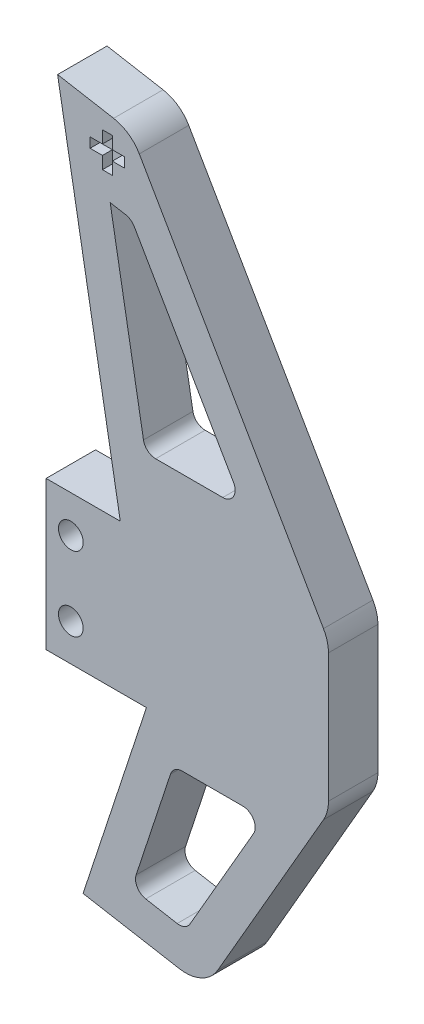
from build123d import *

# Parameters (mm, degrees)
IZIM1_R                     = 2.5
Y_KSEKLIK_EKSTR_ZYON1_DEPTH = 10
RADYUS1_R                   = 7.5
RADYUS2_R                   = 7.5
KES_EKSTR_ZYON1_DEPTH       = 10
KES_EKSTR_ZYON2_DEPTH       = 2


with BuildPart() as part:
    # Çizim1 → Yükseklik-Ekstrüzyon1 (new body)
    with BuildSketch(Plane.XY):
        Polygon((-26.066455833, 76.796612605), (-11.294339538, 74.19188994), (28.705660462, 4.909857637), (28.705660462, -25.090142363), (3.705660462, -68.391412552), (-20.914533363, -64.05020811), (-8.101071955, -25.090142363), (-28.390881377, -25.090142363), (-28.390881377, 4.909857637), (-13.390881377, 4.909857637), align=None)
        with Locations((-23.390881377, -2.590142363)):
            Circle(IZIM1_R, mode=Mode.SUBTRACT)
        with Locations((-23.390881377, -17.590142363)):
            Circle(IZIM1_R, mode=Mode.SUBTRACT)
    extrude(amount=Y_KSEKLIK_EKSTR_ZYON1_DEPTH)

    # Radyus1
    radyus1_edges = [part.edges().sort_by_distance(p)[0] for p in [
        (-11.294339538, 74.19188994, 5),
    ]]
    fillet(radyus1_edges, radius=RADYUS1_R)

    # Radyus2
    radyus2_edges = [part.edges().sort_by_distance(p)[0] for p in [
        (28.705660462, 4.909857637, 5),
        (28.705660462, -25.090142363, 5),
        (3.705660462, -68.391412552, 5),
    ]]
    fillet(radyus2_edges, radius=RADYUS2_R)

    # Çizim2 → Kes-Ekstrüzyon1 (cut)
    with BuildSketch(Plane.XY.offset(10)):
        with BuildLine():
            Line((-15.434488962, 59.690510809), (-8.698721777, 21.490076831))
            ThreePointArc((-8.698721777, 21.490076831), (-7.843671419, 20.009086168), (-6.236702395, 19.424197275))
            Line((-6.236702395, 19.424197275), (7.335421508, 19.424197275))
            ThreePointArc((7.335421508, 19.424197275), (9.500485018, 20.674197275), (9.500485018, 23.174197275))
            Line((9.500485018, 23.174197275), (-10.56271444, 57.924678099))
            ThreePointArc((-10.56271444, 57.924678099), (-11.293836859, 58.72255821), (-12.293657506, 59.136697482))
            Line((-12.293657506, 59.136697482), (-15.434488962, 59.690510809))
        make_face()
        with BuildLine():
            Line((-8.242164507, -58.66898906), (-1.887676329, -59.789456774))
            ThreePointArc((-1.887676329, -59.789456774), (-0.39701023, -59.593206859), (0.711507625, -58.577437392))
            Line((0.711507625, -58.577437392), (13.550215896, -36.340142363))
            ThreePointArc((13.550215896, -36.340142363), (13.550215896, -33.840142363), (11.385152387, -32.590142363))
            Line((11.385152387, -32.590142363), (-0.86299285, -32.590142363))
            ThreePointArc((-0.86299285, -32.590142363), (-2.328828905, -33.064969615), (-3.237849836, -34.309082635))
            Line((-3.237849836, -34.309082635), (-10.182901048, -55.42590995))
            ThreePointArc((-10.182901048, -55.42590995), (-9.953266447, -57.490722349), (-8.242164507, -58.66898906))
        make_face()
    extrude(amount=-KES_EKSTR_ZYON1_DEPTH, mode=Mode.SUBTRACT)

    # Çizim3 → Kes-Ekstrüzyon2 (cut)
    with BuildSketch(Plane.XY.offset(10)):
        Polygon((-17, 71.667807617), (-15, 71.667807617), (-15, 69.167807617), (-12.5, 69.167807617), (-12.5, 67.167807617), (-15, 67.167807617), (-15, 64.667807617), (-17, 64.667807617), (-17, 67.167807617), (-19.5, 67.167807617), (-19.5, 69.167807617), (-17, 69.167807617), align=None)
    extrude(amount=-KES_EKSTR_ZYON2_DEPTH, mode=Mode.SUBTRACT)


solid = part.part
